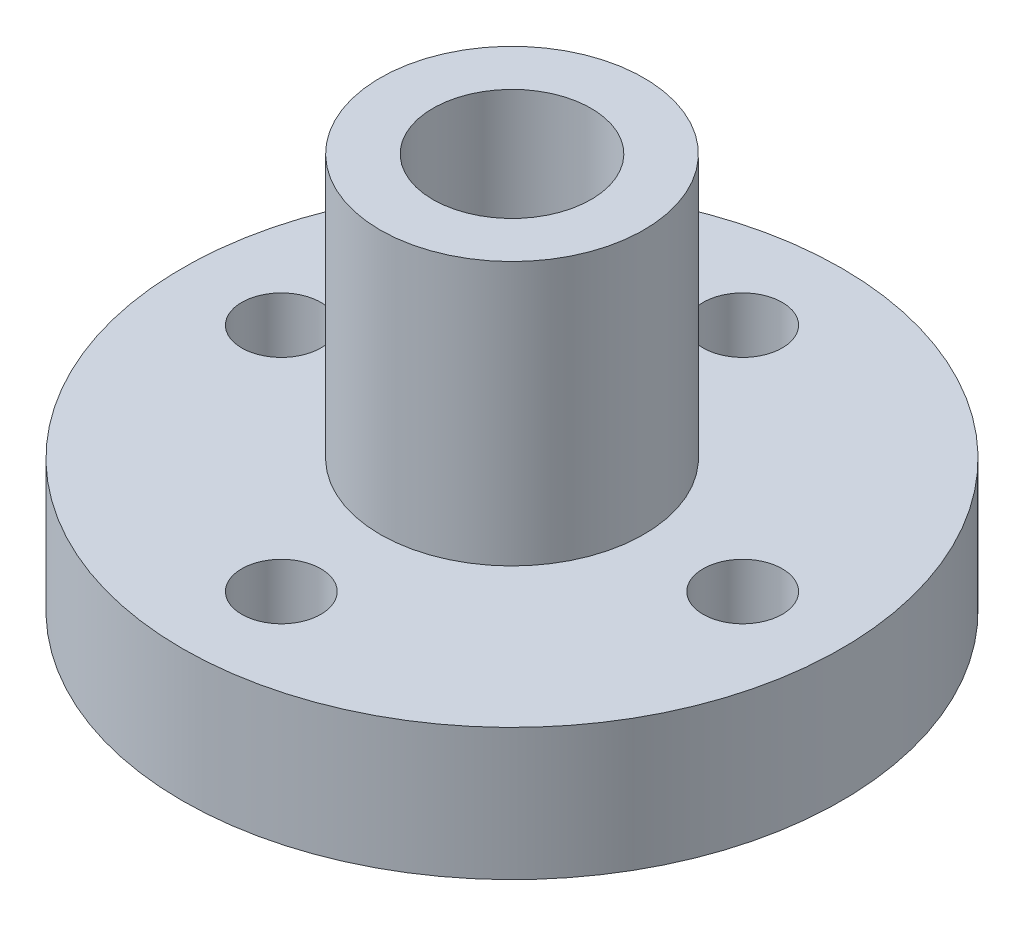
from build123d import *

# Parameters (mm, degrees)
SKETCH1_R           = 5
SKETCH1_R_2         = 3
BOSS_EXTRUDE1_DEPTH = 10
SKETCH2_R           = 12.5
BOSS_EXTRUDE2_DEPTH = 5
SKETCH6_R           = 1.5
CUT_EXTRUDE1_DEPTH  = 5
SKETCH7_R           = 1.5
CUT_EXTRUDE2_DEPTH  = 5
SKETCH8_R           = 3
CUT_EXTRUDE3_DEPTH  = 5


with BuildPart() as part:
    # Sketch1 → Boss-Extrude1 (new body)
    with BuildSketch(Plane(origin=(0, 0, 0), x_dir=(1, 0, 0), z_dir=(0, 1, 0))):
        with Locations(Location((0, 0, 0), (0, 0, 270))):
            Circle(SKETCH1_R)
        with Locations(Location((0, 0, 0), (0, 0, 270))):
            Circle(SKETCH1_R_2, mode=Mode.SUBTRACT)
    extrude(amount=-BOSS_EXTRUDE1_DEPTH)

    # Sketch2 → Boss-Extrude2 (add)
    with BuildSketch(Plane.XZ.offset(10)):
        with Locations(Location((0, 0, 0), (0, 0, 270))):
            Circle(SKETCH2_R)
    extrude(amount=BOSS_EXTRUDE2_DEPTH)

    # Sketch6 → Cut-Extrude1 (cut)
    with BuildSketch(Plane(origin=(0, -10, 0), x_dir=(1, 0, 0), z_dir=(0, 1, 0))):
        with Locations(Location((0, 8.75, 0), (0, 0, 270))):
            Circle(SKETCH6_R)
        with Locations(Location((8.75, 0, 0), (0, 0, 270))):
            Circle(SKETCH6_R)
        with Locations(Location((0, -8.75, 0), (0, 0, 270))):
            Circle(SKETCH6_R)
        with Locations(Location((-8.75, 0, 0), (0, 0, 270))):
            Circle(SKETCH6_R)
    extrude(amount=-CUT_EXTRUDE1_DEPTH, mode=Mode.SUBTRACT)

    # Sketch7 → Cut-Extrude2 (cut)
    with BuildSketch(Plane(origin=(0, 0, -5), x_dir=(-1, 0, 0), z_dir=(0, 0, -1))):
        with Locations((0, -5)):
            Circle(SKETCH7_R)
    extrude(amount=-CUT_EXTRUDE2_DEPTH, mode=Mode.SUBTRACT)

    # Sketch8 → Cut-Extrude3 (cut)
    with BuildSketch(Plane(origin=(0, -10, 0), x_dir=(1, 0, 0), z_dir=(0, 1, 0))):
        with Locations(Location((0, 0, 0), (0, 0, 270))):
            Circle(SKETCH8_R)
    extrude(amount=-CUT_EXTRUDE3_DEPTH, mode=Mode.SUBTRACT)


solid = part.part
